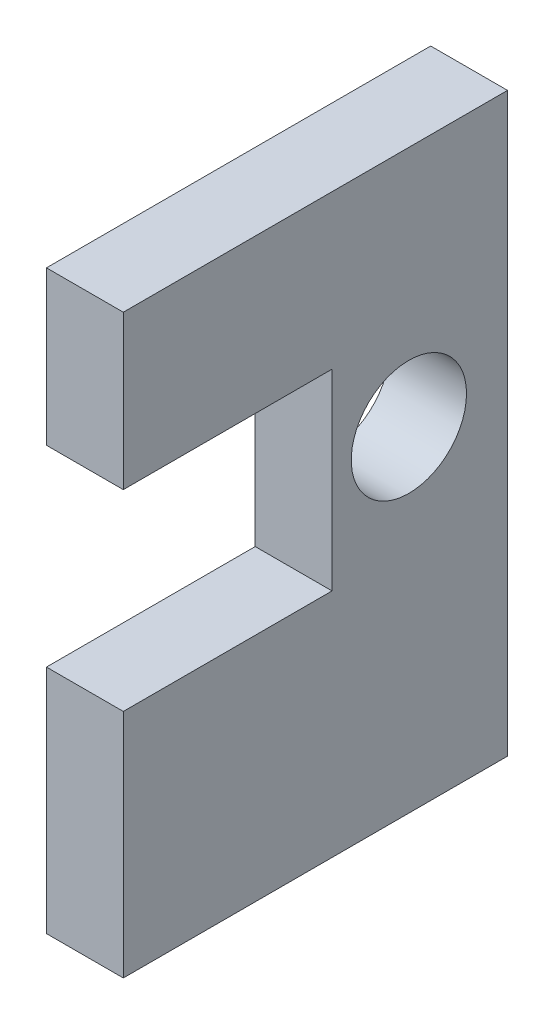
from build123d import *

# Parameters (mm, degrees)
SKETCH1_R           = 1.5
BOSS_EXTRUDE1_DEPTH = 2


with BuildPart() as part:
    # Sketch1 → Boss-Extrude1 (new body)
    with BuildSketch(Plane(origin=(0, 0, 0), x_dir=(0, 0, -1), z_dir=(1, 0, 0))):
        Polygon((0.432432432, -6.97149937), (-5, -6.97149937), (-5, -12.979942714), (5, -12.979942714), (5, 2.027027027), (-5, 2.027027027), (-5, -1.972972973), (0.432432432, -1.972972973), align=None)
        with Locations((2.432432432, -4.272972973)):
            Circle(SKETCH1_R, mode=Mode.SUBTRACT)
    extrude(amount=BOSS_EXTRUDE1_DEPTH)


solid = part.part
